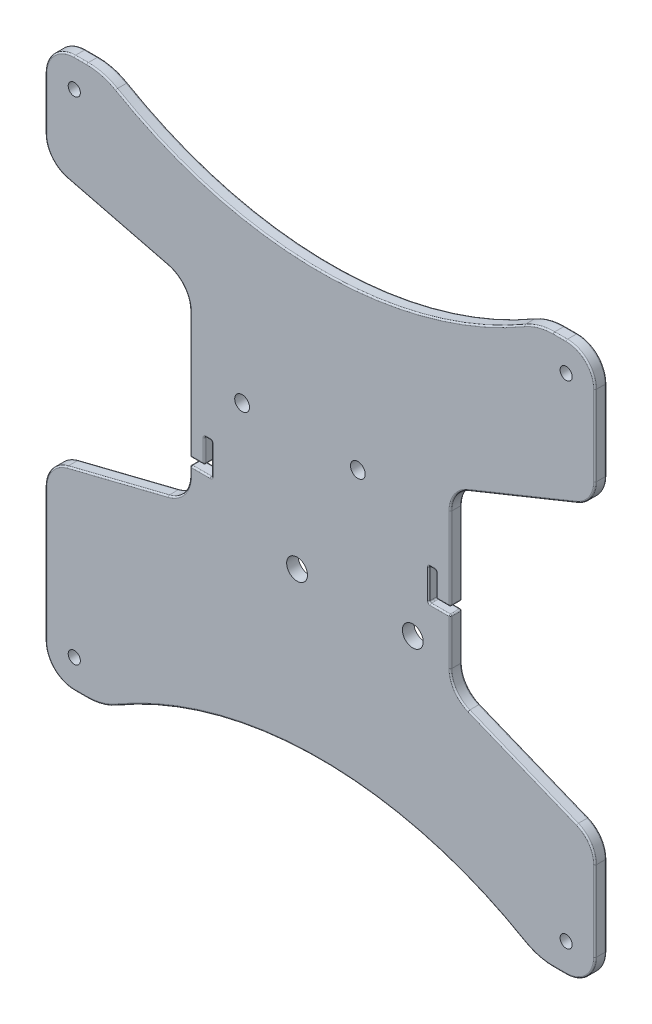
from build123d import *

# Parameters (mm, degrees)
CROQUIS1_R              = 2.1
CROQUIS1_R_2            = 2.55
CROQUIS1_R_3            = 3.6
SALIENTE_EXTRUIR1_DEPTH = 4
REDONDEO1_R             = 0.5


with BuildPart() as part:
    # Croquis1 → Saliente-Extruir1 (new body)
    with BuildSketch(Plane(origin=(0, 0, 0), x_dir=(-1, 0, 0), z_dir=(0, 0, -1))):
        with BuildLine():
            Line((87.42535625, -29.106339063), (52.57464375, -20.393660937))
            ThreePointArc((52.57464375, -20.393660937), (47.11794562, -16.84635803), (45, -10.692235936))
            Line((45, -10.692235936), (45, -8))
            ThreePointArc((45, -8), (44.853553391, -7.646446609), (44.5, -7.5))
            Line((44.5, -7.5), (38, -7.5))
            ThreePointArc((38, -7.5), (37.646446609, -7.353553391), (37.5, -7))
            Line((37.5, -7), (37.5, 3))
            ThreePointArc((37.5, 3), (37.646446609, 3.353553391), (38, 3.5))
            Line((38, 3.5), (39.5, 3.5))
            ThreePointArc((39.5, 3.5), (39.853553391, 3.353553391), (40, 3))
            Line((40, 3), (40, -4.5))
            ThreePointArc((40, -4.5), (40.146446609, -4.853553391), (40.5, -5))
            Line((40.5, -5), (44.5, -5))
            ThreePointArc((44.5, -5), (44.853553391, -4.853553391), (45, -4.5))
            Line((45, -4.5), (45, 38.692235936))
            ThreePointArc((45, 38.692235936), (47.11794562, 44.84635803), (52.57464375, 48.393660937))
            Line((52.57464375, 48.393660937), (87.42535625, 57.106339063))
            ThreePointArc((87.42535625, 57.106339063), (92.88205438, 60.65364197), (95, 66.807764064))
            Line((95, 66.807764064), (95, 85))
            ThreePointArc((95, 85), (92.071067812, 92.071067812), (85, 95))
            Line((85, 95), (80.600023778, 95))
            ThreePointArc((80.600023778, 95), (75.38177505, 94.307249421), (70.525020806, 92.276988022))
            ThreePointArc((70.525020806, 92.276988022), (0, 73.215904175), (-70.525020806, 92.276988022))
            ThreePointArc((-70.525020806, 92.276988022), (-75.38177505, 94.307249421), (-80.600023778, 95))
            Line((-80.600023778, 95), (-85, 95))
            ThreePointArc((-85, 95), (-92.071067812, 92.071067812), (-95, 85))
            Line((-95, 85), (-95, 57.30993956))
            ThreePointArc((-95, 57.30993956), (-93.292887614, 51.721736358), (-88.754396995, 48.041471336))
            Line((-88.754396995, 48.041471336), (-51.245603005, 32.847708996))
            ThreePointArc((-51.245603005, 32.847708996), (-46.707112386, 29.167443975), (-45, 23.579240773))
            Line((-45, 23.579240773), (-45, -4.5))
            ThreePointArc((-45, -4.5), (-44.853553391, -4.853553391), (-44.5, -5))
            Line((-44.5, -5), (-40.5, -5))
            ThreePointArc((-40.5, -5), (-40.146446609, -4.853553391), (-40, -4.5))
            Line((-40, -4.5), (-40, 3))
            ThreePointArc((-40, 3), (-39.853553391, 3.353553391), (-39.5, 3.5))
            Line((-39.5, 3.5), (-38, 3.5))
            ThreePointArc((-38, 3.5), (-37.646446609, 3.353553391), (-37.5, 3))
            Line((-37.5, 3), (-37.5, -7))
            ThreePointArc((-37.5, -7), (-37.646446609, -7.353553391), (-38, -7.5))
            Line((-38, -7.5), (-44.5, -7.5))
            ThreePointArc((-44.5, -7.5), (-44.853553391, -7.646446609), (-45, -8))
            Line((-45, -8), (-45, -23.579240773))
            ThreePointArc((-45, -23.579240773), (-46.707112386, -29.167443975), (-51.245603005, -32.847708996))
            Line((-51.245603005, -32.847708996), (-88.754396995, -48.041471336))
            ThreePointArc((-88.754396995, -48.041471336), (-93.292887614, -51.721736358), (-95, -57.30993956))
            Line((-95, -57.30993956), (-95, -85))
            ThreePointArc((-95, -85), (-92.071067812, -92.071067812), (-85, -95))
            Line((-85, -95), (-80.600023778, -95))
            ThreePointArc((-80.600023778, -95), (-75.38177505, -94.307249421), (-70.525020806, -92.276988022))
            ThreePointArc((-70.525020806, -92.276988022), (0, -73.215904175), (70.525020806, -92.276988022))
            ThreePointArc((70.525020806, -92.276988022), (75.38177505, -94.307249421), (80.600023778, -95))
            Line((80.600023778, -95), (85, -95))
            ThreePointArc((85, -95), (92.071067812, -92.071067812), (95, -85))
            Line((95, -85), (95, -38.807764064))
            ThreePointArc((95, -38.807764064), (92.88205438, -32.65364197), (87.42535625, -29.106339063))
        make_face()
        with Locations(Location((-85, -85, 0), (0, 0, 180))):
            Circle(CROQUIS1_R, mode=Mode.SUBTRACT)
        with Locations(Location((-85, 85, 0), (0, 0, 180))):
            Circle(CROQUIS1_R, mode=Mode.SUBTRACT)
        with Locations(Location((85, 85, 0), (0, 0, 180))):
            Circle(CROQUIS1_R, mode=Mode.SUBTRACT)
        with Locations(Location((85, -85, 0), (0, 0, 180))):
            Circle(CROQUIS1_R, mode=Mode.SUBTRACT)
        with Locations(Location((27, 20.1, 0), (0, 0, 180))):
            Circle(CROQUIS1_R_2, mode=Mode.SUBTRACT)
        with Locations(Location((8, -20.1, 0), (0, 0, 180))):
            Circle(CROQUIS1_R_3, mode=Mode.SUBTRACT)
        with Locations(Location((-32, -20.1, 0), (0, 0, 180))):
            Circle(CROQUIS1_R_3, mode=Mode.SUBTRACT)
        with Locations(Location((-13, 20.1, 0), (0, 0, 180))):
            Circle(CROQUIS1_R_2, mode=Mode.SUBTRACT)
    extrude(amount=-SALIENTE_EXTRUIR1_DEPTH)

    # Redondeo1
    redondeo1_edges = [part.edges().sort_by_distance(p)[0] for p in [
        (75.38177505, 94.307249421, 4),
        (82.800011889, 95, 4),
        (92.071067812, 92.071067812, 4),
        (95, 71.15496978, 4),
        (93.292887614, 51.721736358, 4),
        (70, 40.444590166, 4),
        (46.707112386, 29.167443975, 4),
        (45, 9.539620387, 4),
        (-47.11794562, -16.84635803, 4),
        (44.853553391, -4.853553391, 4),
        (42.5, -5, 4),
        (40.146446609, -4.853553391, 4),
        (40, -0.75, 4),
        (39.853553391, 3.353553391, 4),
        (38.75, 3.5, 4),
        (37.646446609, 3.353553391, 4),
        (37.5, -2, 4),
        (37.646446609, -7.353553391, 4),
        (41.25, -7.5, 4),
        (-45, -9.346117968, 4),
        (44.853553391, -7.646446609, 4),
        (45, -15.789620387, 4),
        (46.707112386, -29.167443975, 4),
        (70, -40.444590166, 4),
        (93.292887614, -51.721736358, 4),
        (95, -71.15496978, 4),
        (92.071067812, -92.071067812, 4),
        (82.800011889, -95, 4),
        (75.38177505, -94.307249421, 4),
        (0, -73.215904175, 4),
        (-44.853553391, -7.646446609, 4),
        (-75.38177505, -94.307249421, 4),
        (-82.800011889, -95, 4),
        (-92.071067812, -92.071067812, 4),
        (-95, -61.903882032, 4),
        (-41.25, -7.5, 4),
        (-37.646446609, -7.353553391, 4),
        (-37.5, -2, 4),
        (-37.646446609, 3.353553391, 4),
        (-38.75, 3.5, 4),
        (-39.853553391, 3.353553391, 4),
        (-40, -0.75, 4),
        (-92.88205438, -32.65364197, 4),
        (-95, -61.903882032, 0),
        (-92.071067812, -92.071067812, 0),
        (-82.800011889, -95, 0),
        (-40.146446609, -4.853553391, 4),
        (-75.38177505, -94.307249421, 0),
        (0, -73.215904175, 0),
        (75.38177505, -94.307249421, 0),
        (82.800011889, -95, 0),
        (92.071067812, -92.071067812, 0),
        (95, -71.15496978, 0),
        (93.292887614, -51.721736358, 0),
        (70, -40.444590166, 0),
        (46.707112386, -29.167443975, 0),
        (45, -15.789620387, 0),
        (-42.5, -5, 4),
        (44.853553391, -7.646446609, 0),
        (41.25, -7.5, 0),
        (37.646446609, -7.353553391, 0),
        (37.5, -2, 0),
        (37.646446609, 3.353553391, 0),
        (38.75, 3.5, 0),
        (39.853553391, 3.353553391, 0),
        (40, -0.75, 0),
        (40.146446609, -4.853553391, 0),
        (42.5, -5, 0),
        (-44.853553391, -4.853553391, 4),
        (44.853553391, -4.853553391, 0),
        (45, 9.539620387, 0),
        (46.707112386, 29.167443975, 0),
        (70, 40.444590166, 0),
        (93.292887614, 51.721736358, 0),
        (95, 71.15496978, 0),
        (92.071067812, 92.071067812, 0),
        (82.800011889, 95, 0),
        (75.38177505, 94.307249421, 0),
        (0, 73.215904175, 0),
        (-45, 17.096117968, 4),
        (-75.38177505, 94.307249421, 0),
        (-82.800011889, 95, 0),
        (-92.071067812, 92.071067812, 0),
        (-95, 75.903882032, 0),
        (-92.88205438, 60.65364197, 0),
        (-70, 52.75, 0),
        (-47.11794562, 44.84635803, 0),
        (-45, 17.096117968, 0),
        (-44.853553391, -4.853553391, 0),
        (-42.5, -5, 0),
        (-47.11794562, 44.84635803, 4),
        (-40.146446609, -4.853553391, 0),
        (-40, -0.75, 0),
        (-39.853553391, 3.353553391, 0),
        (-38.75, 3.5, 0),
        (-37.646446609, 3.353553391, 0),
        (-37.5, -2, 0),
        (-37.646446609, -7.353553391, 0),
        (-41.25, -7.5, 0),
        (-44.853553391, -7.646446609, 0),
        (-45, -9.346117968, 0),
        (-70, 52.75, 4),
        (-47.11794562, -16.84635803, 0),
        (-70, -24.75, 0),
        (-92.88205438, -32.65364197, 0),
        (-92.88205438, 60.65364197, 4),
        (-95, 75.903882032, 4),
        (-92.071067812, 92.071067812, 4),
        (-82.800011889, 95, 4),
        (-70, -24.75, 4),
        (-75.38177505, 94.307249421, 4),
        (0, 73.215904175, 4),
    ]]
    fillet(redondeo1_edges, radius=REDONDEO1_R)


solid = part.part
